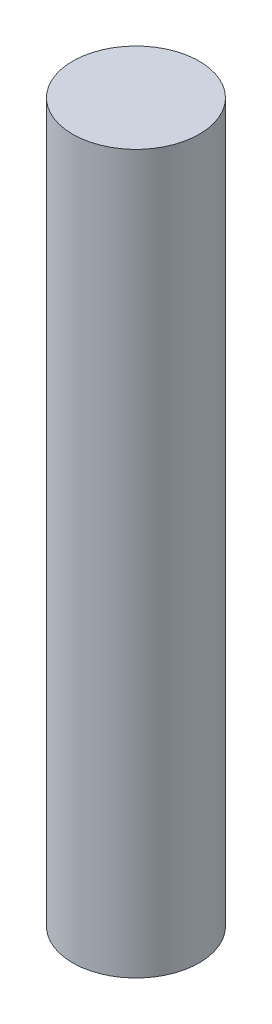
from build123d import *

# Parameters (mm, degrees)
SKETCH1_R           = 1.5
BOSS_EXTRUDE1_DEPTH = 17


with BuildPart() as part:
    # Sketch1 → Boss-Extrude1 (new body)
    with BuildSketch(Plane(origin=(0, 0, 0), x_dir=(1, 0, 0), z_dir=(0, 1, 0))):
        with Locations(Location((0, 0, 0), (0, 0, 270))):
            Circle(SKETCH1_R)
    extrude(amount=BOSS_EXTRUDE1_DEPTH)


solid = part.part
